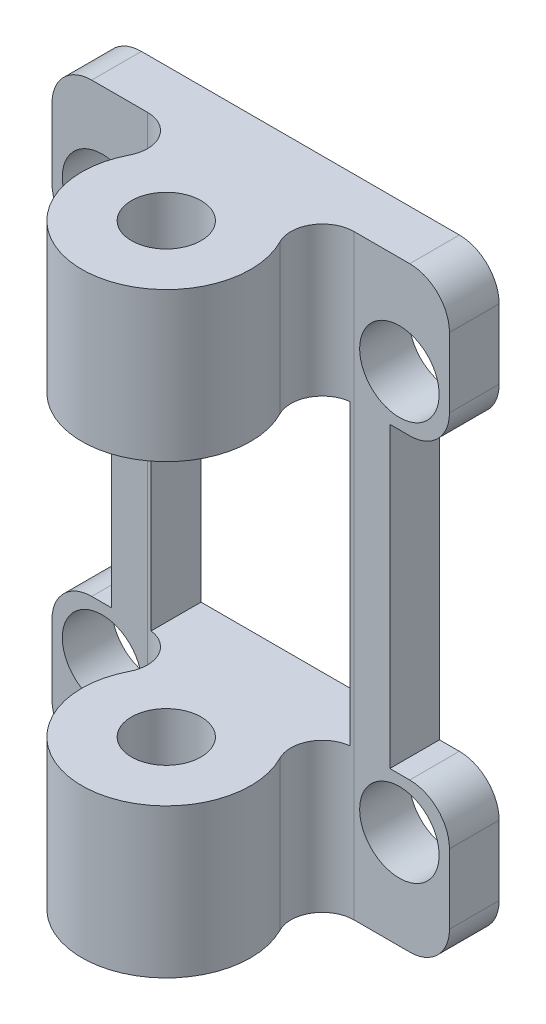
from build123d import *

# Parameters (mm, degrees)
SKETCH1_R           = 2.2225
BOSS_EXTRUDE1_DEPTH = 38.1
SKETCH3_W           = 12.7
SKETCH3_H           = 19.05
CUT_EXTRUDE2_DEPTH  = 43.521276806
SKETCH8_W           = 3.81
SKETCH8_H           = 19.05
CUT_EXTRUDE4_DEPTH  = 42.586422571
FILLET1_R           = 2.54
FILLET2_R           = 2.54
FILLET3_R           = 2.54
FILLET4_R           = 2.54
FILLET5_R           = 2.54
FILLET6_R           = 2.54
FILLET7_R           = 2.54
FILLET8_R           = 2.54
SKETCH9_R           = 2.54
CUT_EXTRUDE5_DEPTH  = 43.521276806


with BuildPart() as part:
    # Sketch1 → Boss-Extrude1 (new body)
    with BuildSketch(Plane(origin=(0, 0, 0), x_dir=(1, 0, 0), z_dir=(0, 1, 0))):
        with BuildLine():
            Line((-12.7, 8.572431324), (12.7, 8.572431324))
            Line((12.7, 8.572431324), (12.7, 5.397431324))
            Line((12.7, 5.397431324), (6.600302959, 5.397431324))
            ThreePointArc((6.600302959, 5.397431324), (4.87882252, 4.432224955), (4.804297319, 2.460027138))
            ThreePointArc((4.804297319, 2.460027138), (0, -5.3975), (-4.804297319, 2.460027138))
            ThreePointArc((-4.804297319, 2.460027138), (-4.87882252, 4.432224955), (-6.600302959, 5.397431324))
            Line((-6.600302959, 5.397431324), (-12.7, 5.397431324))
            Line((-12.7, 5.397431324), (-12.7, 8.572431324))
        make_face()
        with Locations(Location((0, 0, 0), (0, 0, 90))):
            Circle(SKETCH1_R, mode=Mode.SUBTRACT)
    extrude(amount=BOSS_EXTRUDE1_DEPTH)

    # Sketch3 → Cut-Extrude2 (cut, through all)
    with BuildSketch(Plane(origin=(0, 0, -8.572431324), x_dir=(-1, 0, 0), z_dir=(0, 0, -1))):
        with Locations((0, 19.05)):
            Rectangle(SKETCH3_W, SKETCH3_H)
    extrude(amount=-CUT_EXTRUDE2_DEPTH, mode=Mode.SUBTRACT)

    # Sketch8 → Cut-Extrude4 (cut, through all)
    with BuildSketch(Plane.XY.offset(-5.397431324)):
        with Locations((-10.795, 19.05)):
            Rectangle(SKETCH8_W, SKETCH8_H)
        with Locations((10.795, 19.05)):
            Rectangle(SKETCH8_W, SKETCH8_H)
    extrude(amount=-CUT_EXTRUDE4_DEPTH, mode=Mode.SUBTRACT)

    # Fillet1
    fillet1_edges = [part.edges().sort_by_distance(p)[0] for p in [
        (12.7, 38.1, -6.984931324),
    ]]
    fillet(fillet1_edges, radius=FILLET1_R)

    # Fillet2
    fillet2_edges = [part.edges().sort_by_distance(p)[0] for p in [
        (-12.7, 38.1, -6.984931324),
    ]]
    fillet(fillet2_edges, radius=FILLET2_R)

    # Fillet3
    fillet3_edges = [part.edges().sort_by_distance(p)[0] for p in [
        (-12.7, 28.575, -6.984931324),
    ]]
    fillet(fillet3_edges, radius=FILLET3_R)

    # Fillet4
    fillet4_edges = [part.edges().sort_by_distance(p)[0] for p in [
        (12.7, 9.525, -6.984931324),
    ]]
    fillet(fillet4_edges, radius=FILLET4_R)

    # Fillet5
    fillet5_edges = [part.edges().sort_by_distance(p)[0] for p in [
        (12.7, 28.575, -6.984931324),
    ]]
    fillet(fillet5_edges, radius=FILLET5_R)

    # Fillet6
    fillet6_edges = [part.edges().sort_by_distance(p)[0] for p in [
        (-12.7, 9.525, -6.984931324),
    ]]
    fillet(fillet6_edges, radius=FILLET6_R)

    # Fillet7
    fillet7_edges = [part.edges().sort_by_distance(p)[0] for p in [
        (-12.7, 0, -6.984931324),
    ]]
    fillet(fillet7_edges, radius=FILLET7_R)

    # Fillet8
    fillet8_edges = [part.edges().sort_by_distance(p)[0] for p in [
        (12.7, 0, -6.984931324),
    ]]
    fillet(fillet8_edges, radius=FILLET8_R)

    # Sketch9 → Cut-Extrude5 (cut, through all)
    with BuildSketch(Plane(origin=(0, 0, -8.572431324), x_dir=(-1, 0, 0), z_dir=(0, 0, -1))):
        with Locations((9.499999999, 31.800000027)):
            Circle(SKETCH9_R)
        with Locations((-9.499999999, 31.800000027)):
            Circle(SKETCH9_R)
        with Locations((9.499999999, 6.299999973)):
            Circle(SKETCH9_R)
        with Locations((-9.499999999, 6.299999973)):
            Circle(SKETCH9_R)
    extrude(amount=-CUT_EXTRUDE5_DEPTH, mode=Mode.SUBTRACT)


solid = part.part
